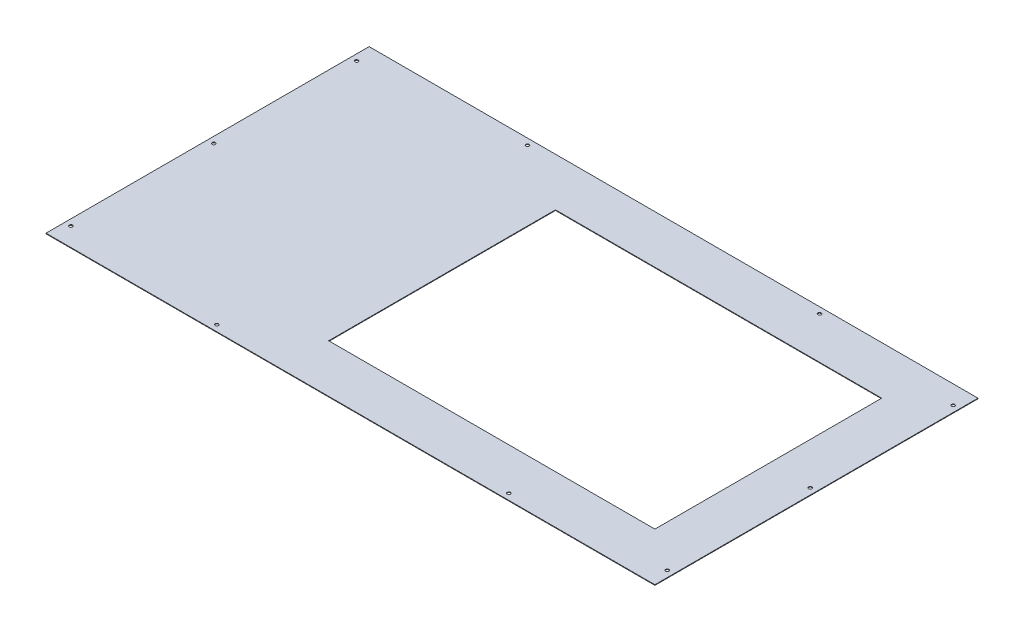
from build123d import *

# Parameters (mm, degrees)
SKETCH1_W               = 1244.6
SKETCH1_H               = 660.4
SKETCH1_W_2             = 666.75
SKETCH1_H_2             = 463.55
BOSS_EXTRUDE1_DEPTH     = 1.2192
F_1_4_CLEARANCE_HOLE1_D = 6.7564


with BuildPart() as part:
    # Sketch1 → Boss-Extrude1 (new body)
    with BuildSketch(Plane(origin=(0, 0, 0), x_dir=(1, 0, 0), z_dir=(0, 1, 0))):
        with Locations((-359.165172795, -51.008449371)):
            Rectangle(SKETCH1_W, SKETCH1_H)
        with Locations((-168.665172795, -51.008449371)):
            Rectangle(SKETCH1_W_2, SKETCH1_H_2, mode=Mode.SUBTRACT)
    extrude(amount=BOSS_EXTRUDE1_DEPTH)

    # 1/4 Clearance Hole1 (through all)
    with Locations(Plane(origin=(0, 0, 0), x_dir=(-1, 0, 0), z_dir=(0, -1, 0))):
        with Locations((968.765172795, 241.091550629), (968.765172795, -51.008449371), (968.765172795, -343.108449371), (644.915172795, -368.508449371), (644.915172795, 266.491550629), (48.015172795, 266.491550629), (-250.434827205, 241.091550629), (-250.434827205, -51.008449371), (-250.434827205, -343.108449371), (48.015172795, -368.508449371)):
            Hole(F_1_4_CLEARANCE_HOLE1_D / 2)


solid = part.part
